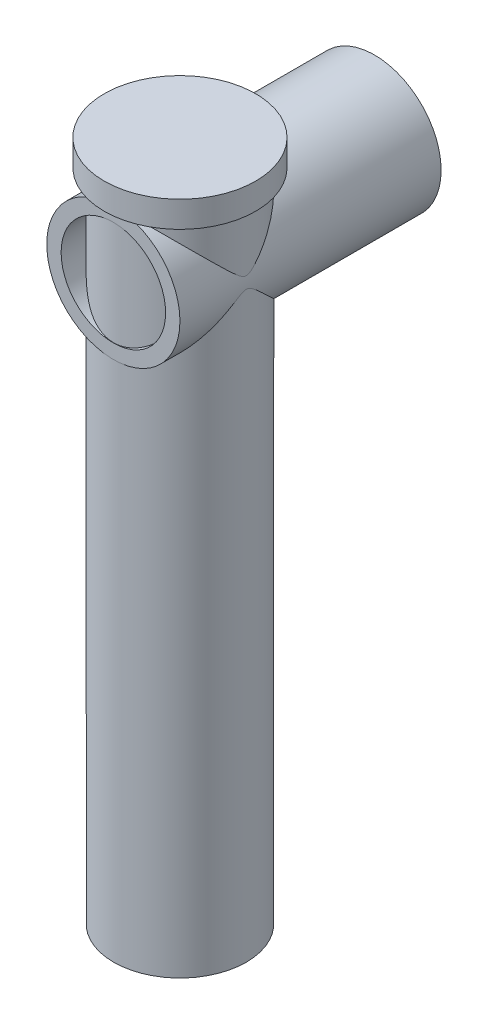
from build123d import *

# Parameters (mm, degrees)
CROQUIS1_R                   = 12.75
CROQUIS1_R_2                 = 10
SALIENTE_EXTRUIR1_DEPTH      = 50
SALIENTE_EXTRUIR2_DEPTH      = 25.4
SALIENTE_EXTRUIR2_DEPTH_BACK = 100
CROQUIS2_R                   = 12.7
CORTAR_EXTRUIR1_DEPTH        = 113.528052203
CORTAR_EXTRUIR1_DEPTH_BACK   = 113.528052203
CROQUIS3_R                   = 10
CROQUIS4_R                   = 10
CORTAR_EXTRUIR2_DEPTH        = 42
CROQUIS5_R                   = 14.5
SALIENTE_EXTRUIR4_DEPTH      = 5


with BuildPart() as part:
    # Croquis1 → Saliente-Extruir1 (new body)
    with BuildSketch(Plane.XY):
        Circle(CROQUIS1_R)
        Circle(CROQUIS1_R_2, mode=Mode.SUBTRACT)
    extrude(amount=SALIENTE_EXTRUIR1_DEPTH)

    # Croquis2 → Saliente-Extruir2 (add, two sides: drawn at the far end of the back side and taken through both)
    with BuildSketch(Plane(origin=(0, -12.7, 0), x_dir=(1, 0, 0), z_dir=(0, 1, 0)).offset(-SALIENTE_EXTRUIR2_DEPTH_BACK)):
        with Locations(Location((0, -37.25, 0), (0, 0, 90))):
            Circle(CROQUIS2_R)
    extrude(amount=SALIENTE_EXTRUIR2_DEPTH + SALIENTE_EXTRUIR2_DEPTH_BACK)

    # Croquis3 → Cortar-Extruir1 (cut, two sides: drawn at the far end of the back side and taken through both)
    with BuildSketch(Plane(origin=(0, -12.7, 0), x_dir=(1, 0, 0), z_dir=(0, 1, 0)).offset(-CORTAR_EXTRUIR1_DEPTH_BACK)):
        with Locations(Location((0, -37.25, 0), (0, 0, 83.522954936))):
            Circle(CROQUIS3_R)
    extrude(amount=CORTAR_EXTRUIR1_DEPTH + CORTAR_EXTRUIR1_DEPTH_BACK, mode=Mode.SUBTRACT)

    # Croquis4 → Cortar-Extruir2 (cut)
    with BuildSketch(Plane.XY):
        with Locations(Location((0, 0, 0), (0, 0, 180))):
            Circle(CROQUIS4_R)
    extrude(amount=CORTAR_EXTRUIR2_DEPTH, mode=Mode.SUBTRACT)


with BuildPart() as body_2:
    # Croquis5 → Saliente-Extruir4 (new body)
    with BuildSketch(Plane(origin=(0, 12.7, 0), x_dir=(1, 0, 0), z_dir=(0, 1, 0))):
        with Locations(Location((0, -37.25, 0), (0, 0, 270))):
            Circle(CROQUIS5_R)
    extrude(amount=SALIENTE_EXTRUIR4_DEPTH)


solid = Compound([part.part, body_2.part])
